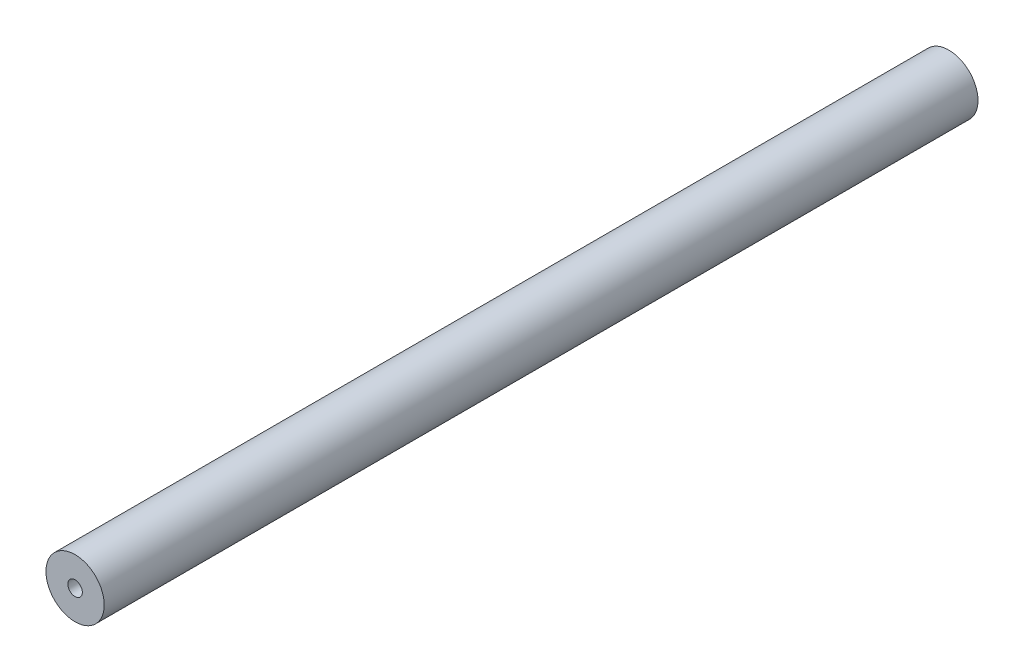
from build123d import *

# Parameters (mm, degrees)
SKETCH1_R           = 40
BOSS_EXTRUDE1_DEPTH = 1200
SKETCH3_R           = 10
CUT_EXTRUDE1_DEPTH  = 1100


with BuildPart() as part:
    # Sketch1 → Boss-Extrude1 (new body)
    with BuildSketch(Plane.XY):
        Circle(SKETCH1_R)
    extrude(amount=BOSS_EXTRUDE1_DEPTH)

    # Sketch3 → Cut-Extrude1 (cut)
    with BuildSketch(Plane.XY.offset(1200)):
        Circle(SKETCH3_R)
    extrude(amount=-CUT_EXTRUDE1_DEPTH, mode=Mode.SUBTRACT)


solid = part.part
